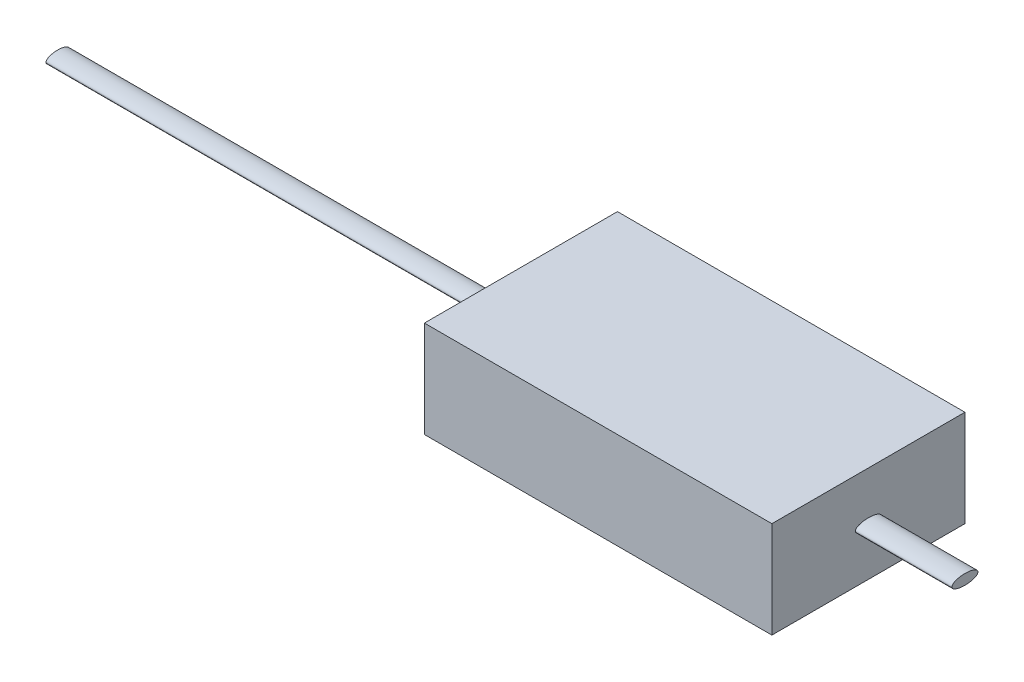
from build123d import *

# Parameters (mm, degrees)
SKETCH1_W           = 90
SKETCH1_H           = 50
BOSS_EXTRUDE1_DEPTH = 25
SKETCH2_RX          = 3.012998166
SKETCH2_RY          = 1.246882068
BOSS_EXTRUDE2_DEPTH = 120
SKETCH3_RX          = 3.386952559
SKETCH3_RY          = 1.327839356
BOSS_EXTRUDE3_DEPTH = 25


with BuildPart() as part:
    # Sketch1 → Boss-Extrude1 (new body)
    with BuildSketch(Plane(origin=(0, 0, 0), x_dir=(1, 0, 0), z_dir=(0, 1, 0))):
        with Locations((-42.805614477, -21.913)):
            Rectangle(SKETCH1_W, SKETCH1_H)
    extrude(amount=BOSS_EXTRUDE1_DEPTH)

    # Sketch2 → Boss-Extrude2 (add)
    with BuildSketch(Plane.ZY.offset(87.805614477)):
        with Locations((21.913, 12.5)):
            Ellipse(SKETCH2_RX, SKETCH2_RY)
    extrude(amount=BOSS_EXTRUDE2_DEPTH)

    # Sketch3 → Boss-Extrude3 (add)
    with BuildSketch(Plane(origin=(2.194385523, 0, 0), x_dir=(0, 0, -1), z_dir=(1, 0, 0))):
        with Locations((-21.913, 12.5)):
            Ellipse(SKETCH3_RX, SKETCH3_RY)
    extrude(amount=BOSS_EXTRUDE3_DEPTH)


solid = part.part
